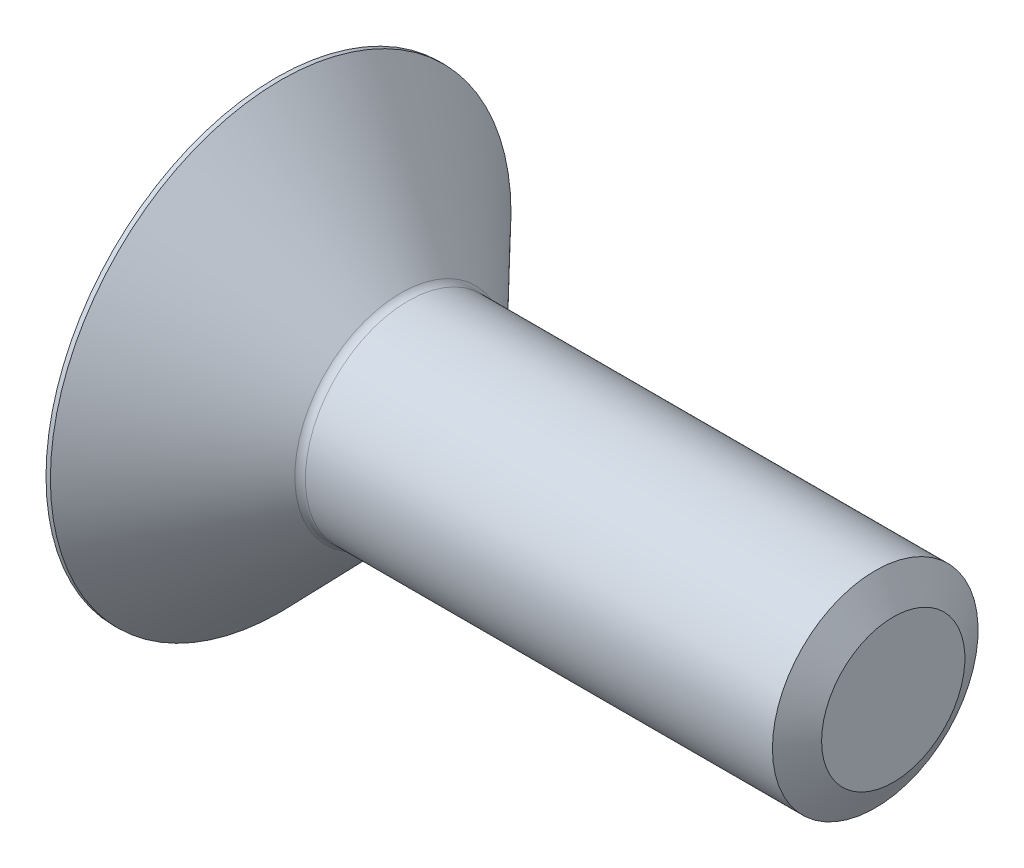
from build123d import *

# Parameters (mm, degrees)
CUT_EXTRUDE_1_DEPTH = 2.48


with BuildPart() as part:
    # 草图1 → 旋转1 (revolve)
    with BuildSketch(Plane.XY):
        with BuildLine():
            Line((0, 2), (-9.435105037, 2))
            ThreePointArc((-9.435105037, 2), (-9.513251262, 2.015899029), (-9.578972997, 2.061068326))
            Line((-9.578972997, 2.061068326), (-11.914908162, 4.48))
            Line((-11.914908162, 4.48), (-12, 4.48))
            Line((-12, 4.48), (-12, 0))
            Line((-12, 0), (0, 0))
            Line((0, 0), (0, 2))
        make_face()
    revolve(axis=Axis((0, 0, 0), (-1, 0, 0)))

    # 草图2 → 切除-拉伸1 (cut)
    with BuildSketch(Plane.ZY.offset(12)):
        Polygon((0, 1.443375673), (-1.25, 0.721687836), (-1.25, -0.721687836), (0, -1.443375673), (1.25, -0.721687836), (1.25, 0.721687836), align=None)
    extrude(amount=-CUT_EXTRUDE_1_DEPTH, mode=Mode.SUBTRACT)

    # 草图6 → 旋转2 (revolve)
    with BuildSketch(Plane.XY):
        Polygon((-10.5, 1.443375673), (-9.666666667, 0), (-9.15, 0), (-9.15, 1.443375673), align=None)
    revolve(axis=Axis((-12, 0, 0), (1, 0, 0)))

    # 草图7 → 切除-旋转2 (revolve, cut)
    with BuildSketch(Plane.XY):
        Polygon((-12, 1.443375673), (-12, 0), (-11.63, 0), align=None)
    revolve(axis=Axis((-12, 0, 0), (1, 0, 0)), mode=Mode.SUBTRACT)

    # 草图4 → 切除-旋转1 (revolve, cut)
    with BuildSketch(Plane.XY):
        Polygon((-0.35, 2), (0, 1.393782217), (0.35, 2), align=None)
    revolve(axis=Axis((-0.35, 0, 0), (1, 0, 0)), mode=Mode.SUBTRACT)


solid = part.part
